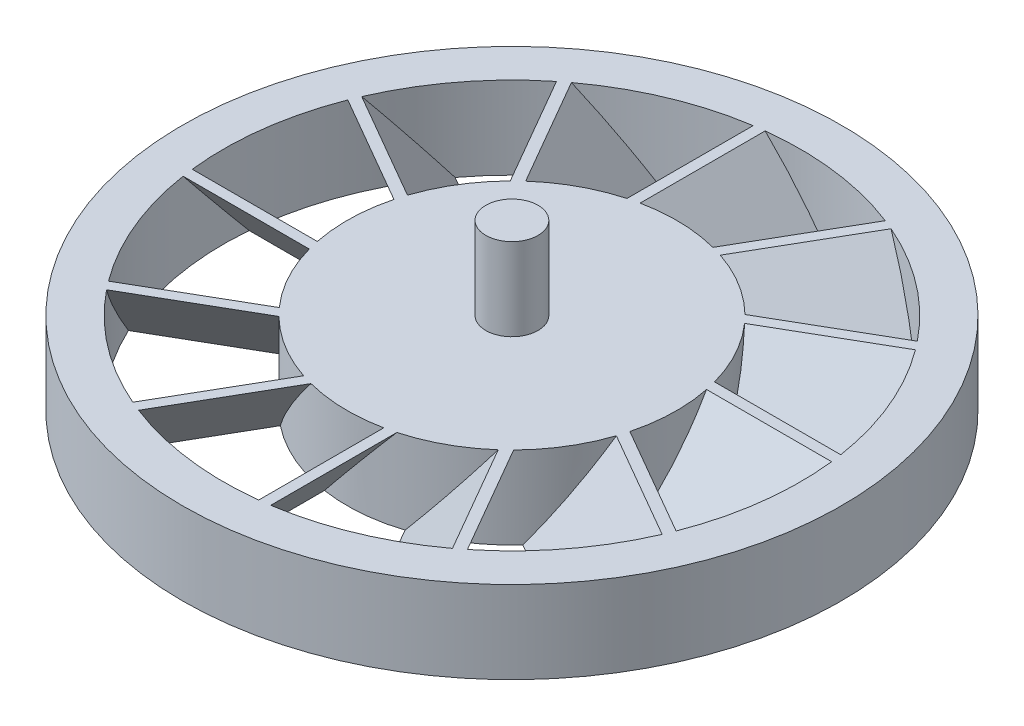
from build123d import *

# Parameters (mm, degrees)
SKETCH1_R                            = 20
BOSS_EXTRUDE1_DEPTH                  = 10
SKETCH1_R_2                          = 40
SKETCH1_R_3                          = 35
BOSS_EXTRUDE1_2_DEPTH                = 10
BOSS_EXTRUDE2_REACH                  = 89.446
BOSS_EXTRUDE2_END_RADIUS             = 35
BOSS_EXTRUDE2_START                  = 30
BOSS_EXTRUDE2_DIRECTION_2_REACH      = 89.446
BOSS_EXTRUDE2_DIRECTION_2_END_RADIUS = 20
CIRPATTERN1_COUNT                    = 12
SKETCH5_R                            = 3.167731354
BOSS_EXTRUDE3_DEPTH                  = 10
SCALE1_SCALE                         = 0.75


with BuildPart() as part:
    # Sketch1 → Boss-Extrude1 (new body)
    with BuildSketch(Plane(origin=(0, 0, 0), x_dir=(1, 0, 0), z_dir=(0, 1, 0))):
        with Locations(Location((0, 0, 0), (0, 0, 270))):
            Circle(SKETCH1_R)
    extrude(amount=BOSS_EXTRUDE1_DEPTH)


with BuildPart() as body_2:
    # Sketch1 → Boss-Extrude1 2 (new body)
    with BuildSketch(Plane(origin=(0, 0, 0), x_dir=(1, 0, 0), z_dir=(0, 1, 0))):
        with Locations(Location((0, 0, 0), (0, 0, 270))):
            Circle(SKETCH1_R_2)
        with Locations(Location((0, 0, 0), (0, 0, 270))):
            Circle(SKETCH1_R_3, mode=Mode.SUBTRACT)
    extrude(amount=BOSS_EXTRUDE1_2_DEPTH)


    add(part.part)  # Boss-Extrude2 merges part
    # Boss-Extrude2: up to this cylinder (the profile starts inside it)
    boss_extrude2_end = Plane(origin=(0, 5, 0), z_dir=(0, -1, 0)) * Cylinder(BOSS_EXTRUDE2_END_RADIUS, 249.892, mode=Mode.PRIVATE)
    # Sketch4 → Boss-Extrude2 (add, up to the surface)
    with BuildSketch(Plane(origin=(0, 0, 0), x_dir=(0, 0, -1), z_dir=(1, 0, 0)).offset(BOSS_EXTRUDE2_START), mode=Mode.PRIVATE) as boss_extrude2_sk1:
        Polygon((-4.262410526, 0), (4.031443844, 10), (5.315133993, 10), (-2.978720377, 0), align=None)
    boss_extrude2_tool1 = extrude(boss_extrude2_sk1.sketch, amount=BOSS_EXTRUDE2_REACH, mode=Mode.PRIVATE) & boss_extrude2_end
    boss_extrude2 = boss_extrude2_tool1.solids().sort_by_distance((30, 5, -0.526362))[0]
    add(boss_extrude2)

    # Boss-Extrude2 direction 2: up to this cylinder (the profile starts outside it)
    boss_extrude2_direction_2_end = Plane(origin=(0, 5, 0), z_dir=(0, -1, 0)) * Cylinder(BOSS_EXTRUDE2_DIRECTION_2_END_RADIUS, 219.892, mode=Mode.PRIVATE)
    # Sketch4 → Boss-Extrude2 direction 2 (add, up to the surface)
    with BuildSketch(Plane(origin=(0, 0, 0), x_dir=(0, 0, -1), z_dir=(1, 0, 0)).offset(BOSS_EXTRUDE2_START), mode=Mode.PRIVATE) as boss_extrude2_direction_2_sk1:
        Polygon((-4.262410526, 0), (4.031443844, 10), (5.315133993, 10), (-2.978720377, 0), align=None)
    boss_extrude2_direction_2_tool1 = extrude(boss_extrude2_direction_2_sk1.sketch, amount=-BOSS_EXTRUDE2_DIRECTION_2_REACH, mode=Mode.PRIVATE) - boss_extrude2_direction_2_end
    boss_extrude2_direction_2 = boss_extrude2_direction_2_tool1.solids().sort_by_distance((30, 5, -0.526362))[0]
    add(boss_extrude2_direction_2)
    boss_extrude2 = boss_extrude2 + boss_extrude2_direction_2  # both directions under the feature's name, for the pattern or mirror that repeats it

    # CirPattern1: Boss-Extrude2 ×12 about axis
    cirpattern1_axis = Axis((0, 0, 0), (0, 1, 0))
    for i in range(1, CIRPATTERN1_COUNT):
        add(boss_extrude2.rotate(cirpattern1_axis, i * 360 / CIRPATTERN1_COUNT))

    # Sketch5 → Boss-Extrude3 (add)
    with BuildSketch(Plane(origin=(0, 10, 0), x_dir=(1, 0, 0), z_dir=(0, 1, 0))):
        with Locations(Location((0, 0, 0), (0, 0, 270))):
            Circle(SKETCH5_R)
    extrude(amount=BOSS_EXTRUDE3_DEPTH)


with BuildPart() as body_2_1:
    # Scale1: scaled about (0, 0, 0)
    add(body_2.part.scale(SCALE1_SCALE))


solid = body_2_1.part
